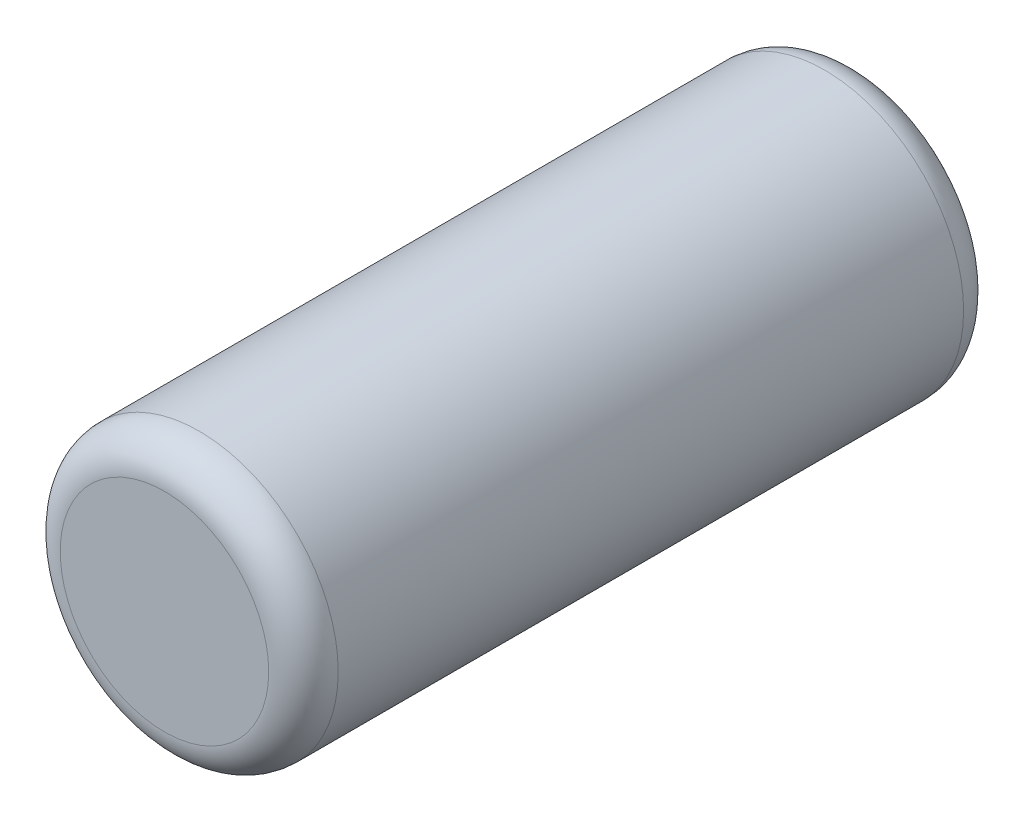
from build123d import *

# Parameters (mm, degrees)
ESQUISSE1_R        = 4
BOSS_EXTRU_1_DEPTH = 20
CONG_1_R           = 1


with BuildPart() as part:
    # Esquisse1 → Boss.-Extru.1 (new body)
    with BuildSketch(Plane.XY):
        Circle(ESQUISSE1_R)
    extrude(amount=BOSS_EXTRU_1_DEPTH)

    # Congé1
    cong_1_edges = [part.edges().sort_by_distance(p)[0] for p in [
        (-4, 0, 0),
        (-4, 0, 20),
    ]]
    fillet(cong_1_edges, radius=CONG_1_R)


solid = part.part
